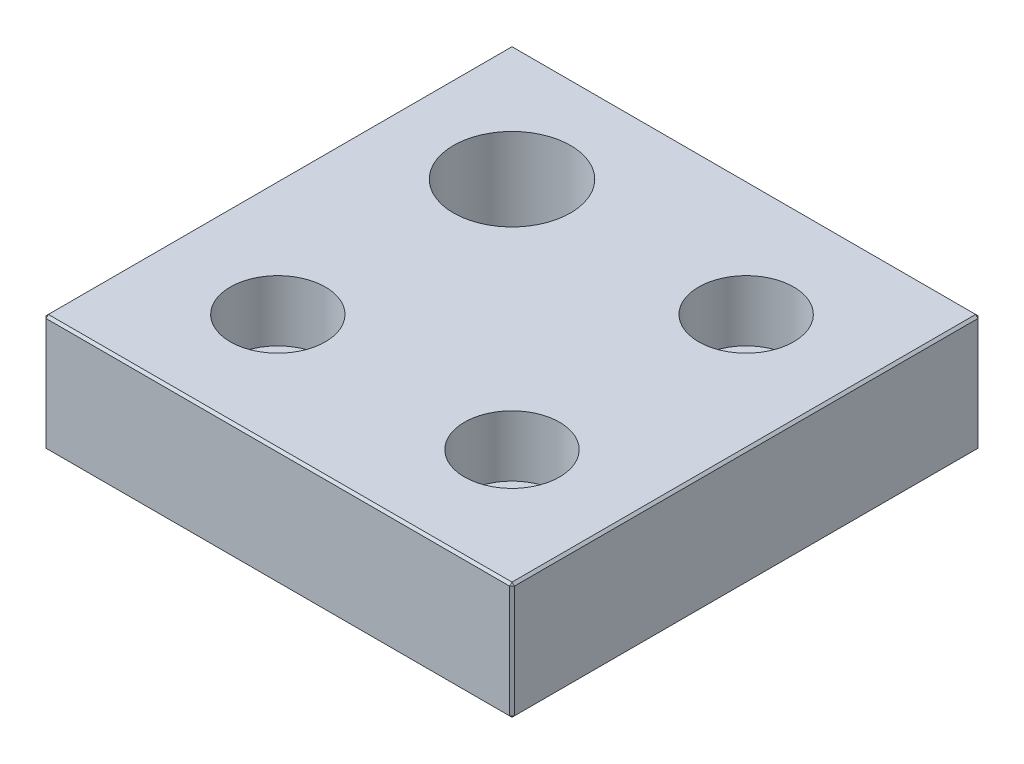
from build123d import *

# Parameters (mm, degrees)
SKETCH1_W          = 50.8
SKETCH1_H          = 50.8
SKETCH1_R          = 6.35
SKETCH1_R_2        = 3.2639
EXTRUDE1_DEPTH     = 12.7
SKETCH2_R          = 5.1562
CUT_EXTRUDE1_DEPTH = 6.604
CHAMFER1_SIZE      = 0.254


with BuildPart() as part:
    # Sketch1 → Extrude1 (new body)
    with BuildSketch(Plane(origin=(0, 0, 0), x_dir=(1, 0, 0), z_dir=(0, 1, 0))):
        with Locations((-25.4, 25.4)):
            Rectangle(SKETCH1_W, SKETCH1_H)
        with Locations(Location((-38.1, 38.1, 0), (0, 0, 270))):
            Circle(SKETCH1_R, mode=Mode.SUBTRACT)
        with Locations(Location((-12.7, 38.1, 0), (0, 0, 270))):
            Circle(SKETCH1_R_2, mode=Mode.SUBTRACT)
        with Locations(Location((-12.7, 12.7, 0), (0, 0, 270))):
            Circle(SKETCH1_R_2, mode=Mode.SUBTRACT)
        with Locations(Location((-38.1, 12.7, 0), (0, 0, 270))):
            Circle(SKETCH1_R_2, mode=Mode.SUBTRACT)
    extrude(amount=EXTRUDE1_DEPTH)

    # Sketch2 → Cut-Extrude1 (cut)
    with BuildSketch(Plane(origin=(0, 12.7, 0), x_dir=(1, 0, 0), z_dir=(0, 1, 0))):
        with Locations(Location((-12.7, 38.1, 0), (0, 0, 270))):
            Circle(SKETCH2_R)
        with Locations(Location((-12.7, 12.7, 0), (0, 0, 270))):
            Circle(SKETCH2_R)
        with Locations(Location((-38.1, 12.7, 0), (0, 0, 270))):
            Circle(SKETCH2_R)
    extrude(amount=-CUT_EXTRUDE1_DEPTH, mode=Mode.SUBTRACT)

    # Chamfer1
    chamfer1_edges = [part.edges().sort_by_distance(p)[0] for p in [
        (-50.8, 12.7, -25.4),
        (-25.4, 12.7, 0),
        (0, 12.7, -25.4),
        (-25.4, 0, 0),
        (-50.8, 0, -25.4),
        (-25.4, 0, -50.8),
        (0, 0, -25.4),
        (-25.4, 12.7, -50.8),
        (0, 6.35, 0),
        (-50.8, 6.35, 0),
        (-50.8, 6.35, -50.8),
        (0, 6.35, -50.8),
    ]]
    chamfer(chamfer1_edges, length=CHAMFER1_SIZE)


solid = part.part
